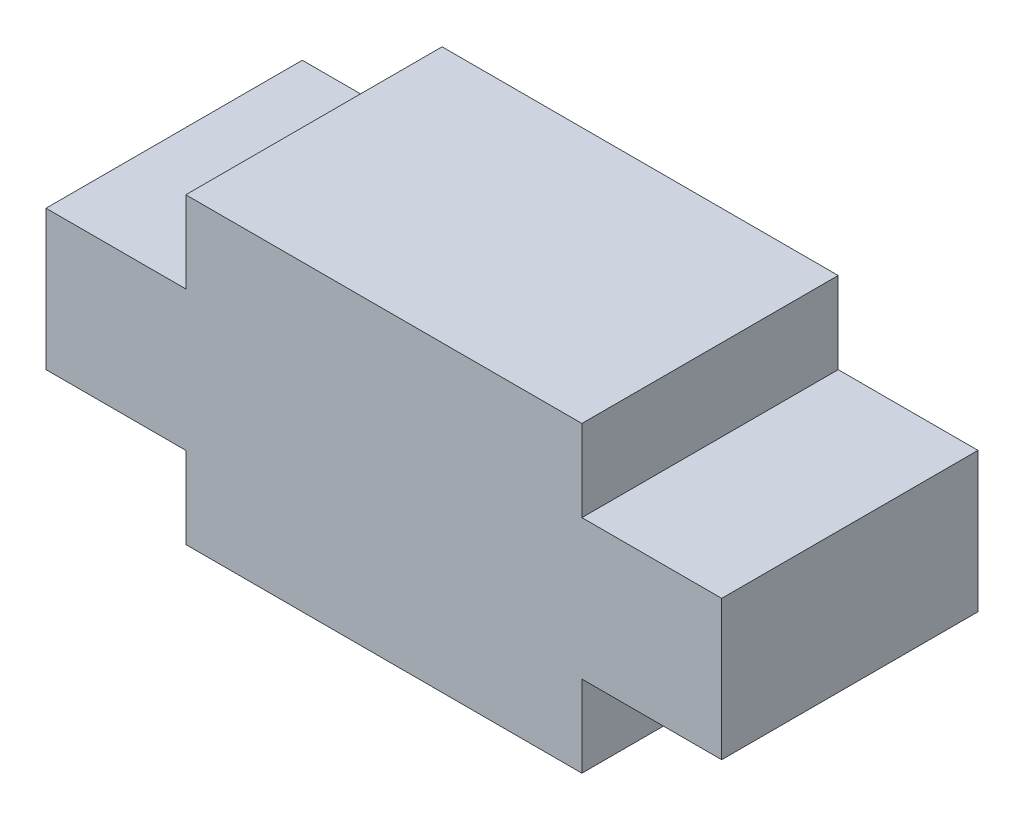
from build123d import *

# Parameters (mm, degrees)
COMPONENT_OUTLINE_DEPTH = 1.1


with BuildPart() as part:
    # 草图1 → Component_Outline (new body)
    with BuildSketch(Plane.XY):
        Polygon((-1.45, -0.3), (-0.85, -0.3), (-0.85, -0.65), (0.85, -0.65), (0.85, -0.3), (1.45, -0.3), (1.45, 0.3), (0.85, 0.3), (0.85, 0.65), (-0.85, 0.65), (-0.85, 0.3), (-1.45, 0.3), align=None)
    extrude(amount=COMPONENT_OUTLINE_DEPTH)


solid = part.part
